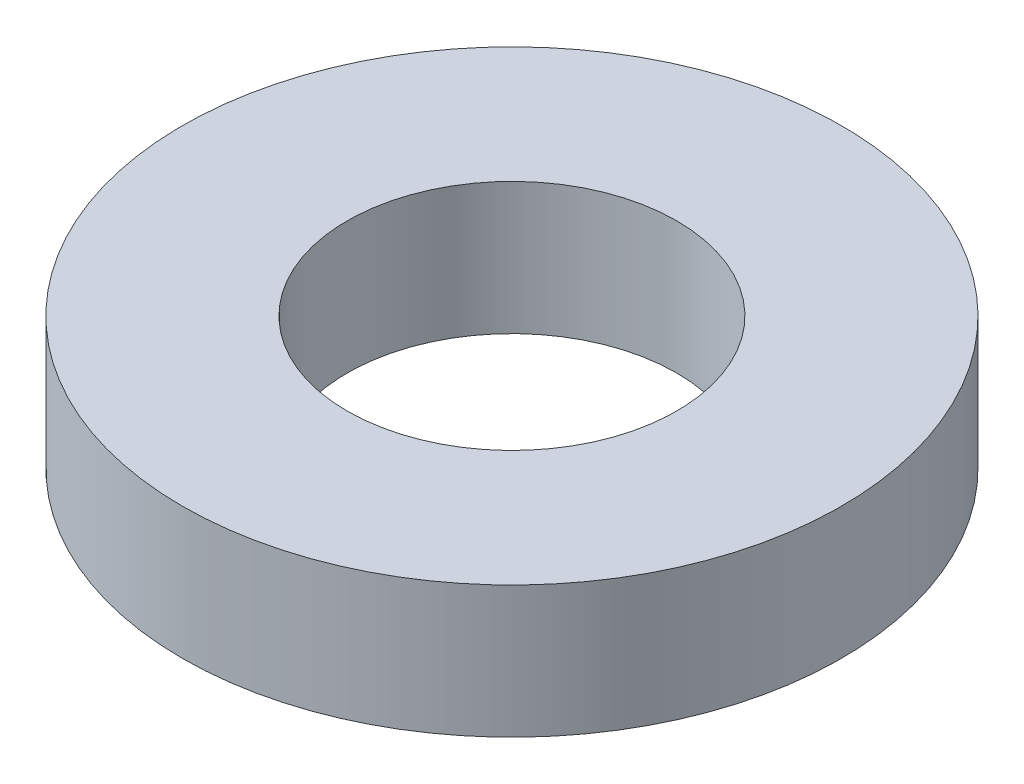
from build123d import *

# Parameters (mm, degrees)
SKETCH1_R           = 6.35
SKETCH1_R_2         = 3.175
BOSS_EXTRUDE1_DEPTH = 2.54


with BuildPart() as part:
    # Sketch1 → Boss-Extrude1 (new body)
    with BuildSketch(Plane(origin=(0, 0, 0), x_dir=(1, 0, 0), z_dir=(0, 1, 0))):
        with Locations(Location((0, 0, 0), (0, 0, 270))):
            Circle(SKETCH1_R)
        with Locations(Location((0, 0, 0), (0, 0, 270))):
            Circle(SKETCH1_R_2, mode=Mode.SUBTRACT)
    extrude(amount=BOSS_EXTRUDE1_DEPTH)


solid = part.part
